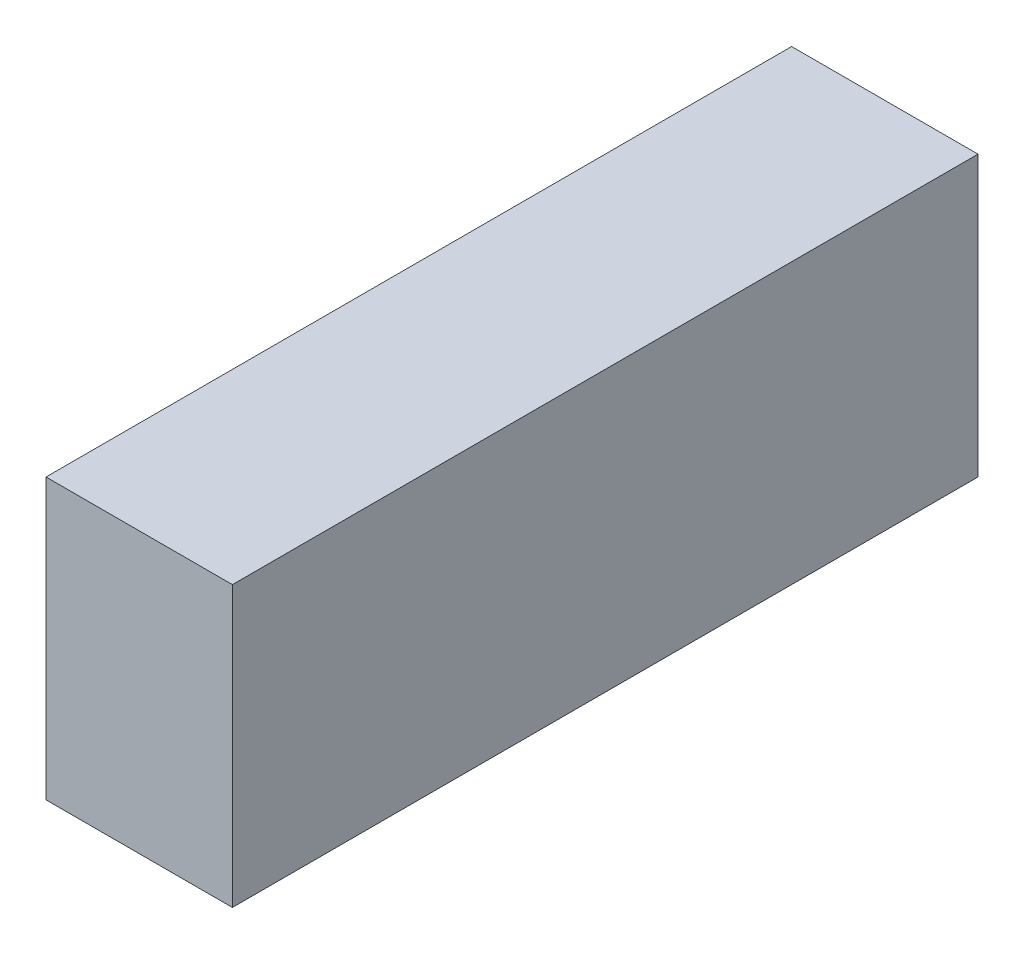
from build123d import *

# Parameters (mm, degrees)
SKETCH1_W           = 25.4
SKETCH1_H           = 38.1
BOSS_EXTRUDE1_DEPTH = 101.6


with BuildPart() as part:
    # Sketch1 → Boss-Extrude1 (new body)
    with BuildSketch(Plane.XY):
        with Locations((12.7, 19.05)):
            Rectangle(SKETCH1_W, SKETCH1_H)
    extrude(amount=BOSS_EXTRUDE1_DEPTH)


solid = part.part
